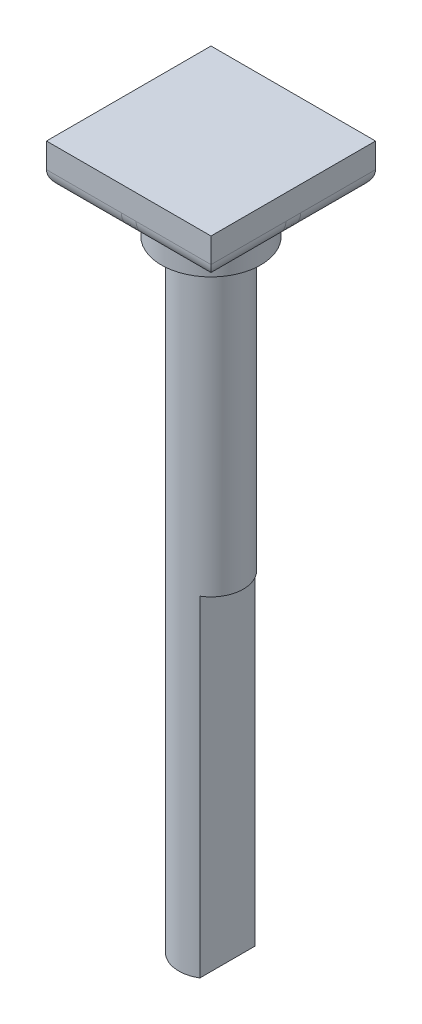
from build123d import *

# Parameters (mm, degrees)
CROQUIS2_W                 = 19.9
CROQUIS2_H                 = 19.9
SALIENTE_EXTRUIR1_DEPTH    = 5
CORTAR_EXTRUIR1_DEPTH      = 87.156862756
CORTAR_EXTRUIR1_DEPTH_BACK = 40
REDONDEO3_R                = 2
REDONDEO4_R                = 2


with BuildPart() as part:
    # Croquis1 → Revolución1 (revolve)
    with BuildSketch(Plane(origin=(0, 0, 0), x_dir=(0, 0, -1), z_dir=(1, 0, 0)), mode=Mode.PRIVATE) as revoluci_n1_sk:
        Polygon((0, 0), (-3.9, 0), (-3.9, 75), (-6, 75), (-6, 80), (0, 80), align=None)
    revolve(revoluci_n1_sk.sketch.rotate(Axis((0, 0, 0), (0, 1, 0)), 180), axis=Axis((0, 0, 0), (0, 1, 0)))

    # Croquis2 → Saliente-Extruir1 (add)
    with BuildSketch(Plane(origin=(0, 80, 0), x_dir=(1, 0, 0), z_dir=(0, 1, 0))):
        Rectangle(CROQUIS2_W, CROQUIS2_H)
    extrude(amount=SALIENTE_EXTRUIR1_DEPTH)

    # Croquis3 → Cortar-Extruir1 (cut, two sides: drawn at the far end of the back side and taken through both)
    with BuildSketch(Plane.XZ.offset(-CORTAR_EXTRUIR1_DEPTH_BACK)):
        Polygon((2, 49.105251298), (2, 3.348133809), (2, -3.348133809), (2, -49.105251298), (93.514234979, -49.105251298), (93.514234979, 49.105251298), align=None)
    extrude(amount=CORTAR_EXTRUIR1_DEPTH + CORTAR_EXTRUIR1_DEPTH_BACK, mode=Mode.SUBTRACT)

    # Redondeo3
    redondeo3_edges = [part.edges().sort_by_distance(p)[0] for p in [
        (0, 80, 6),
    ]]
    fillet(redondeo3_edges, radius=REDONDEO3_R)

    # Redondeo4
    redondeo4_edges = [part.edges().sort_by_distance(p)[0] for p in [
        (0, 80, 9.95),
        (9.95, 80, 0),
        (-9.95, 80, 0),
        (0, 80, -9.95),
    ]]
    fillet(redondeo4_edges, radius=REDONDEO4_R)


solid = part.part
